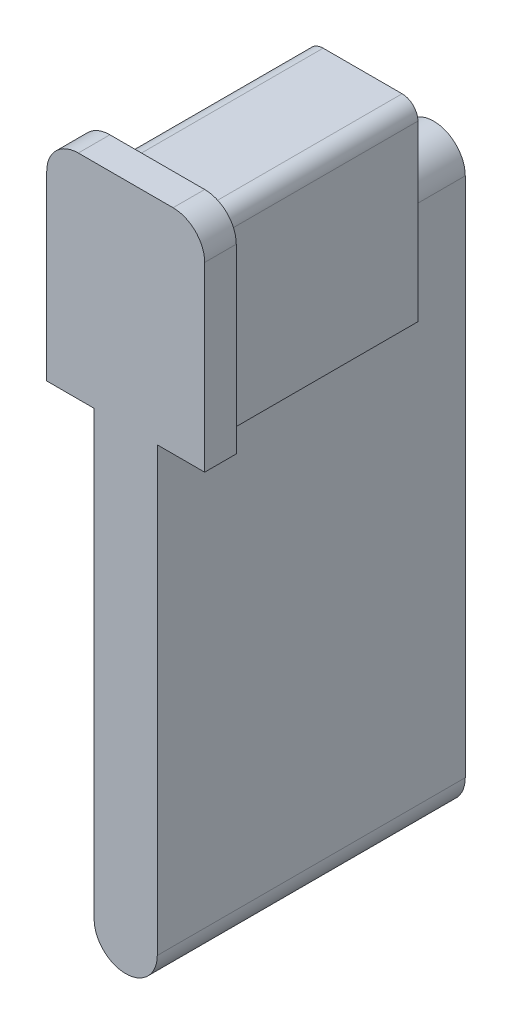
from build123d import *

# Parameters (mm, degrees)
BASE_EXTRUSION_DEPTH = 19.5
ESQUISSE2_W          = 7
ESQUISSE2_H          = 12
BOSS_EXTRU_1_DEPTH   = 15
CONG_1_R             = 1
ESQUISSE3_W          = 10
ESQUISSE3_H          = 13.5
BOSS_EXTRU_2_DEPTH   = 2
CONG_2_R             = 2


with BuildPart() as part:
    # Esquisse1 → Base-Extrusion (new body)
    with BuildSketch(Plane.XY):
        with BuildLine():
            Line((0, 0), (0, 33))
            ThreePointArc((0, 33), (2, 35), (4, 33))
            Line((4, 33), (4, 0))
            ThreePointArc((4, 0), (2, -2), (0, 0))
        make_face()
    extrude(amount=BASE_EXTRUSION_DEPTH)

    # Esquisse2 → Boss.-Extru.1 (add)
    with BuildSketch(Plane.XY.offset(19.5)):
        with Locations((2, 34)):
            Rectangle(ESQUISSE2_W, ESQUISSE2_H)
    extrude(amount=-BOSS_EXTRU_1_DEPTH)

    # Congé1
    cong_1_edges = [part.edges().sort_by_distance(p)[0] for p in [
        (-1.5, 40, 12),
        (5.5, 40, 12),
    ]]
    fillet(cong_1_edges, radius=CONG_1_R)

    # Esquisse3 → Boss.-Extru.2 (add)
    with BuildSketch(Plane.XY.offset(19.5)):
        with Locations((2, 34.75)):
            Rectangle(ESQUISSE3_W, ESQUISSE3_H)
    extrude(amount=-BOSS_EXTRU_2_DEPTH)

    # Congé2
    cong_2_edges = [part.edges().sort_by_distance(p)[0] for p in [
        (-3, 41.5, 18.5),
        (7, 41.5, 18.5),
    ]]
    fillet(cong_2_edges, radius=CONG_2_R)


solid = part.part
